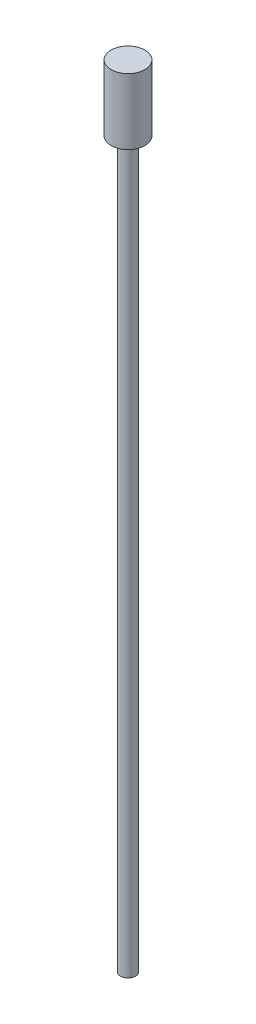
from build123d import *

# Parameters (mm, degrees)
ESQUISSE1_R        = 4
BOSS_EXTRU_1_DEPTH = 385
ESQUISSE2_R        = 9
BOSS_EXTRU_2_DEPTH = 35


with BuildPart() as part:
    # Esquisse1 → Boss.-Extru.1 (new body)
    with BuildSketch(Plane(origin=(0, 0, 0), x_dir=(1, 0, 0), z_dir=(0, 1, 0))):
        with Locations(Location((0, 0, 0), (0, 0, 270))):
            Circle(ESQUISSE1_R)
    extrude(amount=BOSS_EXTRU_1_DEPTH)

    # Esquisse2 → Boss.-Extru.2 (add)
    with BuildSketch(Plane(origin=(0, 385, 0), x_dir=(1, 0, 0), z_dir=(0, 1, 0))):
        with Locations(Location((0, 0, 0), (0, 0, 270))):
            Circle(ESQUISSE2_R)
    extrude(amount=BOSS_EXTRU_2_DEPTH)


solid = part.part
